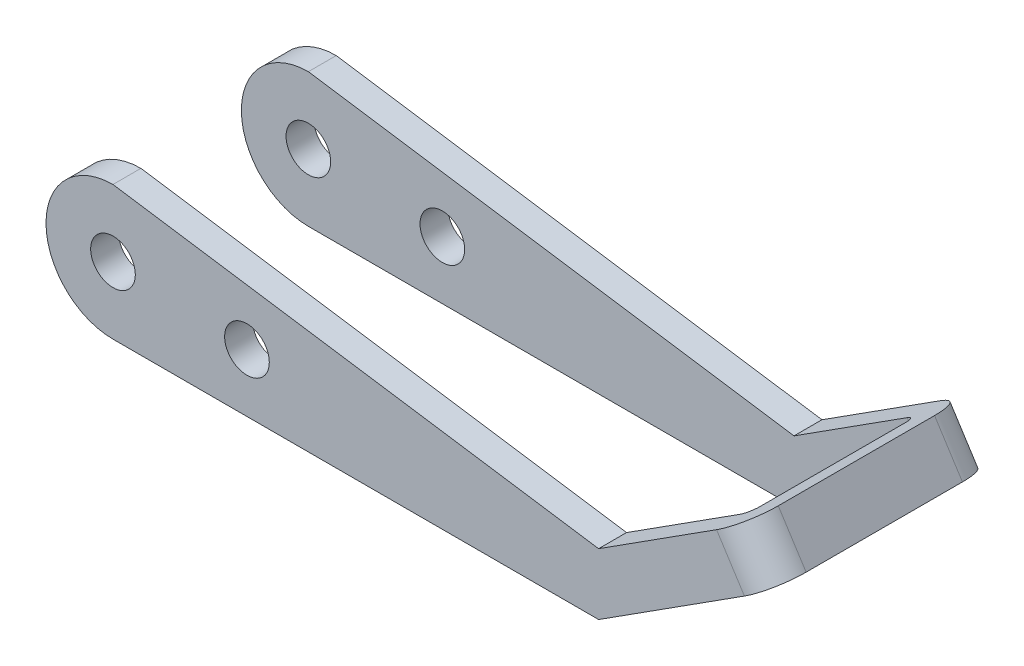
from build123d import *

# Parameters (mm, degrees)
SCHIZZO1_R                   = 2
ESTRUSIONE_ESTRUSIONE1_DEPTH = 2.5
ESTRUSIONE_ESTRUSIONE2_DEPTH = 7.5
TAGLIO_ESTRUSIONE1_DEPTH     = 55.551477823
ESTRUSIONE_ESTRUSIONE3_DEPTH = 4.632546


with BuildPart() as part:
    # Schizzo1 → Estrusione-Estrusione1 (new body)
    with BuildSketch(Plane.XY):
        with BuildLine():
            Line((0, -6), (43.5, -6))
            Line((43.5, -6), (59.085369345, 3.967259523))
            Line((59.085369345, 3.967259523), (56.58948898, 7.869958879))
            Line((56.58948898, 7.869958879), (43.5, -0.501118559))
            Line((43.5, -0.501118559), (0, 6))
            ThreePointArc((0, 6), (-6, 0), (0, -6))
        make_face()
        Circle(SCHIZZO1_R, mode=Mode.SUBTRACT)
        with Locations((12, -0.8)):
            Circle(SCHIZZO1_R, mode=Mode.SUBTRACT)
    extrude(amount=ESTRUSIONE_ESTRUSIONE1_DEPTH)

    # Schizzo3 → Estrusione-Estrusione2 (add)
    with BuildSketch(Plane(origin=(0, 0, 0), x_dir=(-1, 0, 0), z_dir=(0, 0, -1))):
        Polygon((-56.58948898, 7.869958879), (-59.085369345, 3.967259523), (-56.979238352, 2.62033256), (-54.483357987, 6.523031917), align=None)
    extrude(amount=ESTRUSIONE_ESTRUSIONE2_DEPTH)

    # Schizzo4 → Taglio-Estrusione1 (cut, through all)
    with BuildSketch(Plane(origin=(12.854369278, -20.099817049, 0), x_dir=(0.8424523970071469, 0.5387707850068642, 0), z_dir=(-0.5387707850068642, 0.8424523970071469, 0))):
        with BuildLine():
            Line((51.91405456, 0.5), (51.91405456, -2.5))
            Line((51.91405456, -2.5), (48.91405456, -2.5))
            ThreePointArc((48.91405456, -2.5), (51.035374903, -1.621320344), (51.91405456, 0.5))
        make_face()
    extrude(amount=-TAGLIO_ESTRUSIONE1_DEPTH, mode=Mode.SUBTRACT)

    # Schizzo5 → Estrusione-Estrusione3 (add)
    with BuildSketch(Plane(origin=(12.854369278, -20.099817049, 0), x_dir=(0.8424523970071469, 0.5387707850068642, 0), z_dir=(-0.5387707850068642, 0.8424523970071469, 0))):
        with BuildLine():
            Line((49.41405456, 1), (49.41405456, 0))
            Line((49.41405456, 0), (48.41405456, 0))
            ThreePointArc((48.41405456, 0), (49.121161341, 0.292893219), (49.41405456, 1))
        make_face()
    extrude(amount=-ESTRUSIONE_ESTRUSIONE3_DEPTH)

    # Specchia4: part across plane


with BuildPart() as part_1:
    add(part.part)
    add(part.part.mirror(Plane.XY.offset(-7.5)))


solid = part_1.part
